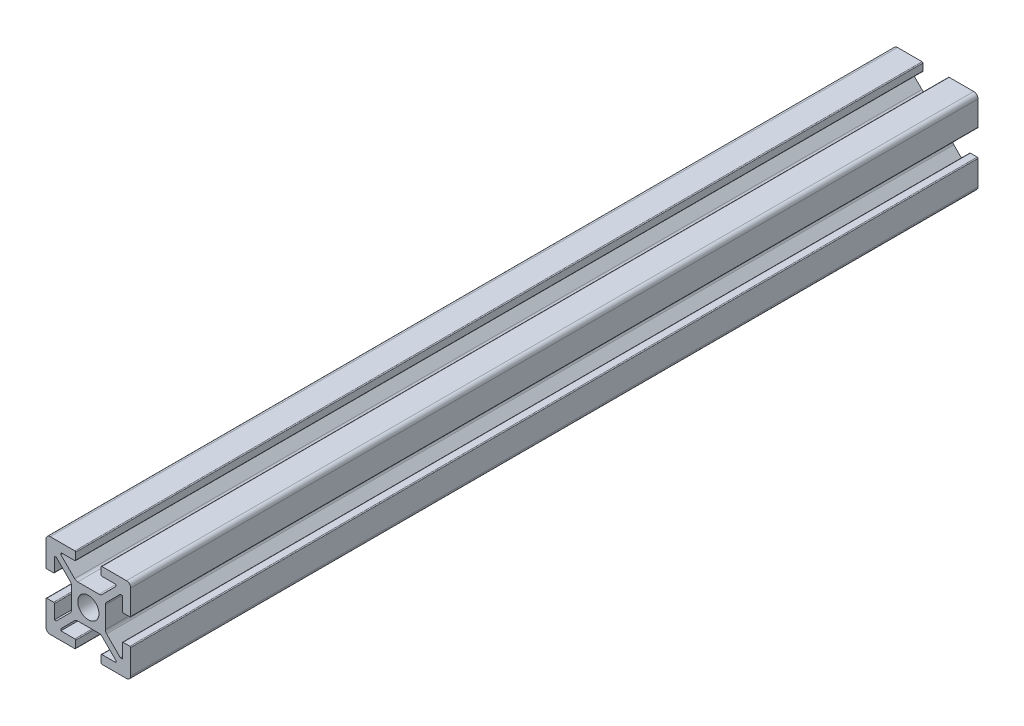
from build123d import *

# Parameters (mm, degrees)
SKETCH1_R           = 2.5
BOSS_EXTRUDE1_DEPTH = 200


with BuildPart() as part:
    # Sketch1 → Boss-Extrude1 (new body)
    with BuildSketch(Plane.XY):
        with BuildLine():
            Line((0.2, 13), (1.8, 13))
            ThreePointArc((1.8, 13), (1.941421356, 13.058578644), (2, 13.2))
            Line((2, 13.2), (2, 16.5))
            Line((2, 16.5), (2.439339828, 16.5))
            Line((2.439339828, 16.5), (5.707106781, 13.232233047))
            ThreePointArc((5.707106781, 13.232233047), (5.923879533, 12.907809698), (6, 12.525126266))
            Line((6, 12.525126266), (6, 7.474873734))
            ThreePointArc((6, 7.474873734), (5.923879533, 7.092190302), (5.707106781, 6.767766953))
            Line((5.707106781, 6.767766953), (2.439339828, 3.5))
            Line((2.439339828, 3.5), (2, 3.5))
            Line((2, 3.5), (2, 6.8))
            ThreePointArc((2, 6.8), (1.941421356, 6.941421356), (1.8, 7))
            Line((1.8, 7), (0.2, 7))
            ThreePointArc((0.2, 7), (0.058578644, 6.941421356), (0, 6.8))
            Line((0, 6.8), (0, 1))
            ThreePointArc((0, 1), (0.292893219, 0.292893219), (1, 0))
            Line((1, 0), (6.8, 0))
            ThreePointArc((6.8, 0), (6.941421356, 0.058578644), (7, 0.2))
            Line((7, 0.2), (7, 1.8))
            ThreePointArc((7, 1.8), (6.941421356, 1.941421356), (6.8, 2))
            Line((6.8, 2), (3.5, 2))
            Line((3.5, 2), (3.5, 2.439339828))
            Line((3.5, 2.439339828), (6.767766953, 5.707106781))
            ThreePointArc((6.767766953, 5.707106781), (7.092190302, 5.923879533), (7.474873734, 6))
            Line((7.474873734, 6), (10, 6))
            Line((10, 6), (12.525126266, 6))
            ThreePointArc((12.525126266, 6), (12.907809698, 5.923879533), (13.232233047, 5.707106781))
            Line((13.232233047, 5.707106781), (16.5, 2.439339828))
            Line((16.5, 2.439339828), (16.5, 2))
            Line((16.5, 2), (13.2, 2))
            ThreePointArc((13.2, 2), (13.058578644, 1.941421356), (13, 1.8))
            Line((13, 1.8), (13, 0.2))
            ThreePointArc((13, 0.2), (13.058578644, 0.058578644), (13.2, 0))
            Line((13.2, 0), (19, 0))
            ThreePointArc((19, 0), (19.707106781, 0.292893219), (20, 1))
            Line((20, 1), (20, 6.8))
            ThreePointArc((20, 6.8), (19.941421356, 6.941421356), (19.8, 7))
            Line((19.8, 7), (18.2, 7))
            ThreePointArc((18.2, 7), (18.058578644, 6.941421356), (18, 6.8))
            Line((18, 6.8), (18, 3.5))
            Line((18, 3.5), (17.560660172, 3.5))
            Line((17.560660172, 3.5), (14.292893219, 6.767766953))
            ThreePointArc((14.292893219, 6.767766953), (14.076120467, 7.092190302), (14, 7.474873734))
            Line((14, 7.474873734), (14, 12.525126266))
            ThreePointArc((14, 12.525126266), (14.076120467, 12.907809698), (14.292893219, 13.232233047))
            Line((14.292893219, 13.232233047), (17.560660172, 16.5))
            Line((17.560660172, 16.5), (18, 16.5))
            Line((18, 16.5), (18, 13.2))
            ThreePointArc((18, 13.2), (18.058578644, 13.058578644), (18.2, 13))
            Line((18.2, 13), (19.8, 13))
            ThreePointArc((19.8, 13), (19.941421356, 13.058578644), (20, 13.2))
            Line((20, 13.2), (20, 19))
            ThreePointArc((20, 19), (19.707106781, 19.707106781), (19, 20))
            Line((19, 20), (13.2, 20))
            ThreePointArc((13.2, 20), (13.058578644, 19.941421356), (13, 19.8))
            Line((13, 19.8), (13, 18.2))
            ThreePointArc((13, 18.2), (13.058578644, 18.058578644), (13.2, 18))
            Line((13.2, 18), (16.5, 18))
            Line((16.5, 18), (16.5, 17.560660172))
            Line((16.5, 17.560660172), (13.232233047, 14.292893219))
            ThreePointArc((13.232233047, 14.292893219), (12.907809698, 14.076120467), (12.525126266, 14))
            Line((12.525126266, 14), (10, 14))
            Line((10, 14), (7.474873734, 14))
            ThreePointArc((7.474873734, 14), (7.092190302, 14.076120467), (6.767766953, 14.292893219))
            Line((6.767766953, 14.292893219), (3.5, 17.560660172))
            Line((3.5, 17.560660172), (3.5, 18))
            Line((3.5, 18), (6.8, 18))
            ThreePointArc((6.8, 18), (6.941421356, 18.058578644), (7, 18.2))
            Line((7, 18.2), (7, 19.8))
            ThreePointArc((7, 19.8), (6.941421356, 19.941421356), (6.8, 20))
            Line((6.8, 20), (1, 20))
            ThreePointArc((1, 20), (0.292893219, 19.707106781), (0, 19))
            Line((0, 19), (0, 13.2))
            ThreePointArc((0, 13.2), (0.058578644, 13.058578644), (0.2, 13))
        make_face()
        with Locations((10, 10)):
            Circle(SKETCH1_R, mode=Mode.SUBTRACT)
    extrude(amount=BOSS_EXTRUDE1_DEPTH)


solid = part.part
